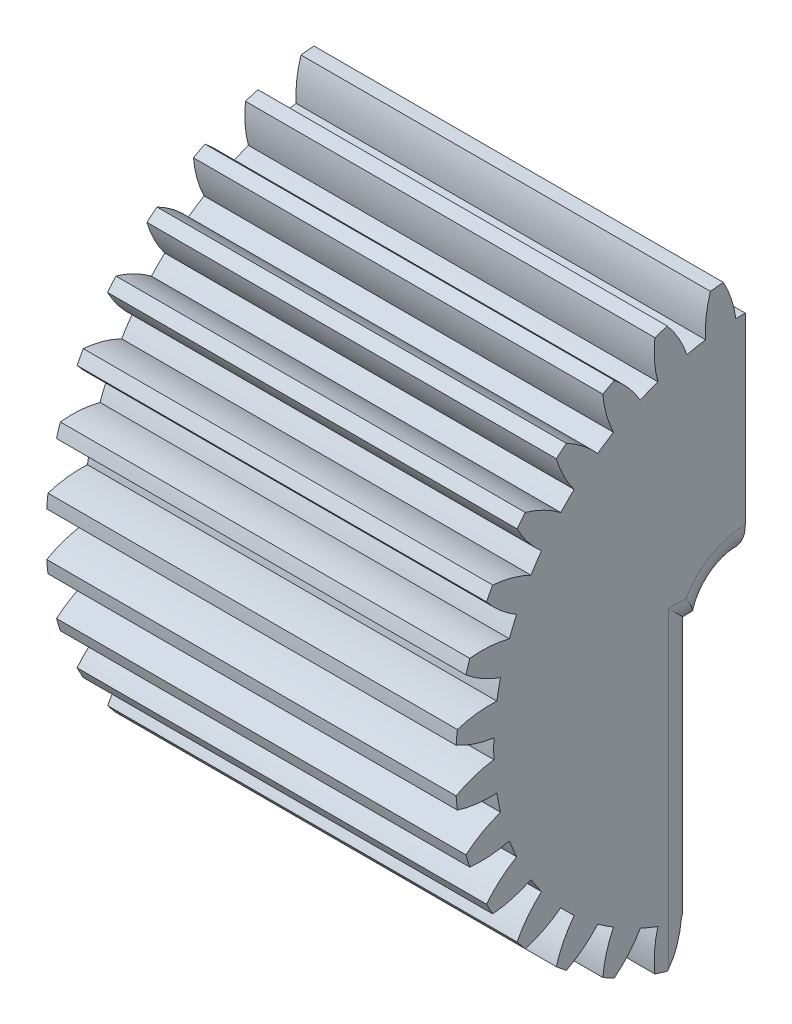
from build123d import *

# Parameters (mm, degrees)
BASPROSKE_W         = 10
BASPROSKE_H         = 8.5
TOOTHCUT_DEPTH      = 16.636495771
TEETHCUTS_COUNT     = 32
TEETHCUTS_ANGLE     = 348.75
BORSKE_R            = 1
BORE_DEPTH          = 50.0000508
SKETCH1_W           = 2.2
SKETCH1_H           = 12
CUT_EXTRUDE1_DEPTH  = 16.610070769
SKETCH4_R           = 1.125
SKETCH4_R_2         = 0.5
BOSS_EXTRUDE1_DEPTH = 0.5
BOSS_EXTRUDE2_REACH = 18.234
SKETCH5_W           = 2.5
SKETCH5_H           = 8.148803967
SKETCH6_R           = 2.25
CUT_EXTRUDE4_DEPTH  = 2.45
SKETCH7_R           = 0.5
CUT_EXTRUDE5_DEPTH  = 2.4
SKETCH8_W           = 11
SKETCH8_H           = 18
CUT_EXTRUDE6_DEPTH  = 10
SKETCH9_W           = 2
SKETCH9_H           = 2
BOSS_EXTRUDE3_DEPTH = 2
SKETCH10_W          = 1.25
SKETCH10_H          = 9
CUT_EXTRUDE7_DEPTH  = 7
BOSS_EXTRUDE4_REACH = 18.961
FILLET2_R           = 1


with BuildPart() as part:
    # BasProSke → Base-Revolve (revolve)
    with BuildSketch(Plane(origin=(0, 0, 0), x_dir=(1, 0, 0), z_dir=(0, 1, 0)), mode=Mode.PRIVATE) as base_revolve_sk:
        with Locations((5, 4.25)):
            Rectangle(BASPROSKE_W, BASPROSKE_H)
    revolve(base_revolve_sk.sketch.rotate(Axis((-10, 0, 0), (1, 0, 0)), 180), axis=Axis((-10, 0, 0), (1, 0, 0)))

    # TooCutSke → ToothCut (cut, through all)
    with BuildSketch(Plane(origin=(0, 0, 0), x_dir=(0, 0, -1), z_dir=(1, 0, 0))):
        with BuildLine():
            ThreePointArc((0.277002447, 7.3687954), (0, 7.374), (-0.277002447, 7.3687954))
            ThreePointArc((-0.277002447, 7.3687954), (-0.41335061, 7.952280695), (-0.656086882, 8.500117362))
            ThreePointArc((-0.656086882, 8.500117362), (0, 8.5254), (0.656086882, 8.500117362))
            ThreePointArc((0.656086882, 8.500117362), (0.41335061, 7.952280695), (0.277002447, 7.3687954))
        make_face()
    toothcut = extrude(amount=TOOTHCUT_DEPTH, mode=Mode.SUBTRACT)

    # TeethCuts: ToothCut ×32 about axis
    teethcuts_axis = Axis((-10, 0, 0), (1, 0, 0))
    for i in range(1, TEETHCUTS_COUNT):
        add(toothcut.rotate(teethcuts_axis, i * TEETHCUTS_ANGLE / (TEETHCUTS_COUNT - 1)), mode=Mode.SUBTRACT)

    # BorSke → Bore (cut, symmetric)
    with BuildSketch(Plane(origin=(0, 0, 0), x_dir=(0, 0, -1), z_dir=(1, 0, 0))):
        with Locations(Location((0, 0, 0), (0, 0, 180))):
            Circle(BORSKE_R)
    extrude(amount=BORE_DEPTH, both=True, mode=Mode.SUBTRACT)

    # Sketch1 → Cut-Extrude1 (cut, through all)
    with BuildSketch(Plane(origin=(10, 0, 0), x_dir=(0, 0, -1), z_dir=(1, 0, 0))):
        with Locations((0, -6)):
            Rectangle(SKETCH1_W, SKETCH1_H)
    extrude(amount=-CUT_EXTRUDE1_DEPTH, mode=Mode.SUBTRACT)

    # Sketch2 → Cut-Revolve1 (revolve, cut)
    with BuildSketch(Plane.XY):
        with BuildLine():
            Line((3.25, 0), (8.75, 0))
            ThreePointArc((8.75, 0), (6, 2.75), (3.25, 0))
        make_face()
    revolve(axis=Axis((3.25, 0, 0), (1, 0, 0)), mode=Mode.SUBTRACT)

    # Sketch4 → Boss-Extrude1 (add)
    with BuildSketch(Plane.ZY.offset(-3)):
        Circle(SKETCH4_R)
        Circle(SKETCH4_R_2, mode=Mode.SUBTRACT)
    extrude(amount=BOSS_EXTRUDE1_DEPTH)

    # Sketch5 → Boss-Extrude2 (add, up to next)
    with BuildSketch(Plane.XY.offset(-1.1), mode=Mode.PRIVATE) as boss_extrude2_sk1:
        with Locations((1.25, -4.074401984)):
            Rectangle(SKETCH5_W, SKETCH5_H)
    boss_extrude2_tool1 = extrude(boss_extrude2_sk1.sketch, amount=BOSS_EXTRUDE2_REACH, mode=Mode.PRIVATE) - part.part
    add(boss_extrude2_tool1.solids().sort_by_distance((1.25, -4.074402, -1.1))[0])

    # Sketch6 → Cut-Extrude4 (cut)
    with BuildSketch(Plane.ZY):
        Circle(SKETCH6_R)
    extrude(amount=-CUT_EXTRUDE4_DEPTH, mode=Mode.SUBTRACT)

    # Sketch7 → Cut-Extrude5 (cut)
    with BuildSketch(Plane(origin=(2.5, 0, 0), x_dir=(0, 0, -1), z_dir=(1, 0, 0))):
        with Locations(Location((0, 0, 0), (0, 0, 180))):
            Circle(SKETCH7_R)
    extrude(amount=-CUT_EXTRUDE5_DEPTH, mode=Mode.SUBTRACT)

    # Sketch8 → Cut-Extrude6 (cut)
    with BuildSketch(Plane.XY):
        with Locations((5, 0)):
            Rectangle(SKETCH8_W, SKETCH8_H)
    extrude(amount=-CUT_EXTRUDE6_DEPTH, mode=Mode.SUBTRACT)

    # Sketch9 → Boss-Extrude3 (add)
    with BuildSketch(Plane(origin=(0, 0, 0), x_dir=(-1, 0, 0), z_dir=(0, 0, -1))):
        with Locations((-7.5, 4.75)):
            Rectangle(SKETCH9_W, SKETCH9_H)
        with Locations((-2.5, 4.75)):
            Rectangle(SKETCH9_W, SKETCH9_H)
    extrude(amount=BOSS_EXTRUDE3_DEPTH)

    # Sketch10 → Cut-Extrude7 (cut)
    with BuildSketch(Plane(origin=(10, 0, 0), x_dir=(0, 0, -1), z_dir=(1, 0, 0))):
        with Locations((-0.625, -4.5)):
            Rectangle(SKETCH10_W, SKETCH10_H)
    extrude(amount=-CUT_EXTRUDE7_DEPTH, mode=Mode.SUBTRACT)

    # Sketch11 → Boss-Extrude4 (add, up to next)
    with BuildSketch(Plane(origin=(12, 0, 0), x_dir=(0, 0, -1), z_dir=(1, 0, 0)), mode=Mode.PRIVATE) as boss_extrude4_sk1:
        with BuildLine():
            Line((-1.25, 0), (-1.25, -7.267281197))
            ThreePointArc((-1.25, -7.267281197), (-1.480378414, -7.223874013), (-1.70926059, -7.173165566))
            ThreePointArc((-1.70926059, -7.173165566), (-1.949908855, -7.706695879), (-2.283707519, -8.187470914))
            ThreePointArc((-2.283707519, -8.187470914), (-2.467419757, -8.133992854), (-2.649881718, -8.076393185))
            ThreePointArc((-2.649881718, -8.076393185), (-2.660320865, -7.491194752), (-2.563999025, -6.913883496))
            ThreePointArc((-2.563999025, -6.913883496), (-2.82190763, -6.812687673), (-3.075832807, -6.701875002))
            ThreePointArc((-3.075832807, -6.701875002), (-3.415943684, -7.178205532), (-3.837123056, -7.584621721))
            ThreePointArc((-3.837123056, -7.584621721), (-4.006872263, -7.496330747), (-4.174591131, -7.404241277))
            ThreePointArc((-4.174591131, -7.404241277), (-4.070663142, -6.828250691), (-3.86356426, -6.280823768))
            ThreePointArc((-3.86356426, -6.280823768), (-4.096774898, -6.131256921), (-4.324202495, -5.97303514))
            ThreePointArc((-4.324202495, -5.97303514), (-4.750705713, -6.373860772), (-5.243080107, -6.690299769))
            ThreePointArc((-5.243080107, -6.690299769), (-5.392342915, -6.570588854), (-5.538873348, -6.447548529))
            ThreePointArc((-5.538873348, -6.447548529), (-5.324572118, -5.902900785), (-5.014654888, -5.406395505))
            ThreePointArc((-5.014654888, -5.406395505), (-5.214205404, -5.214205404), (-5.406395505, -5.014654888))
            ThreePointArc((-5.406395505, -5.014654888), (-5.902900785, -5.324572118), (-6.447548529, -5.538873348))
            ThreePointArc((-6.447548529, -5.538873348), (-6.570588854, -5.392342915), (-6.690299769, -5.243080107))
            ThreePointArc((-6.690299769, -5.243080107), (-6.373860772, -4.750705713), (-5.97303514, -4.324202495))
            ThreePointArc((-5.97303514, -4.324202495), (-6.131256921, -4.096774898), (-6.280823768, -3.86356426))
            ThreePointArc((-6.280823768, -3.86356426), (-6.828250691, -4.070663142), (-7.404241277, -4.174591131))
            ThreePointArc((-7.404241277, -4.174591131), (-7.496330747, -4.006872263), (-7.584621721, -3.837123056))
            ThreePointArc((-7.584621721, -3.837123056), (-7.178205532, -3.415943684), (-6.701875002, -3.075832807))
            ThreePointArc((-6.701875002, -3.075832807), (-6.812687673, -2.82190763), (-6.913883496, -2.563999025))
            ThreePointArc((-6.913883496, -2.563999025), (-7.491194752, -2.660320865), (-8.076393185, -2.649881718))
            ThreePointArc((-8.076393185, -2.649881718), (-8.133992854, -2.467419757), (-8.187470914, -2.283707519))
            ThreePointArc((-8.187470914, -2.283707519), (-7.706695879, -1.949908855), (-7.173165566, -1.70926059))
            ThreePointArc((-7.173165566, -1.70926059), (-7.232310658, -1.438596035), (-7.281246559, -1.165900745))
            ThreePointArc((-7.281246559, -1.165900745), (-7.866256399, -1.14774395), (-8.438173832, -1.023338837))
            ThreePointArc((-8.438173832, -1.023338837), (-8.459070177, -0.833145693), (-8.475680191, -0.642530382))
            ThreePointArc((-8.475680191, -0.642530382), (-7.939022225, -0.408940123), (-7.3687954, -0.277002447))
            ThreePointArc((-7.3687954, -0.277002447), (-7.374, 0), (-7.3687954, 0.277002447))
            ThreePointArc((-7.3687954, 0.277002447), (-7.939022225, 0.408940123), (-8.475680191, 0.642530382))
            ThreePointArc((-8.475680191, 0.642530382), (-8.459070177, 0.833145693), (-8.438173832, 1.023338837))
            ThreePointArc((-8.438173832, 1.023338837), (-7.866256399, 1.14774395), (-7.281246559, 1.165900745))
            ThreePointArc((-7.281246559, 1.165900745), (-7.232310658, 1.438596035), (-7.173165566, 1.70926059))
            ThreePointArc((-7.173165566, 1.70926059), (-7.706695879, 1.949908855), (-8.187470914, 2.283707519))
            ThreePointArc((-8.187470914, 2.283707519), (-8.133992854, 2.467419757), (-8.076393185, 2.649881718))
            ThreePointArc((-8.076393185, 2.649881718), (-7.491194752, 2.660320865), (-6.913883496, 2.563999025))
            ThreePointArc((-6.913883496, 2.563999025), (-6.812687673, 2.82190763), (-6.701875002, 3.075832807))
            ThreePointArc((-6.701875002, 3.075832807), (-7.178205532, 3.415943684), (-7.584621721, 3.837123056))
            ThreePointArc((-7.584621721, 3.837123056), (-7.496330747, 4.006872263), (-7.404241277, 4.174591131))
            ThreePointArc((-7.404241277, 4.174591131), (-6.828250691, 4.070663142), (-6.280823768, 3.86356426))
            ThreePointArc((-6.280823768, 3.86356426), (-6.131256921, 4.096774898), (-5.97303514, 4.324202495))
            ThreePointArc((-5.97303514, 4.324202495), (-6.373860772, 4.750705713), (-6.690299769, 5.243080107))
            ThreePointArc((-6.690299769, 5.243080107), (-6.570588854, 5.392342915), (-6.447548529, 5.538873348))
            ThreePointArc((-6.447548529, 5.538873348), (-5.902900785, 5.324572118), (-5.406395505, 5.014654888))
            ThreePointArc((-5.406395505, 5.014654888), (-5.214205404, 5.214205404), (-5.014654888, 5.406395505))
            ThreePointArc((-5.014654888, 5.406395505), (-5.324572118, 5.902900785), (-5.538873348, 6.447548529))
            ThreePointArc((-5.538873348, 6.447548529), (-5.392342915, 6.570588854), (-5.243080107, 6.690299769))
            ThreePointArc((-5.243080107, 6.690299769), (-4.750705713, 6.373860772), (-4.324202495, 5.97303514))
            ThreePointArc((-4.324202495, 5.97303514), (-4.096774898, 6.131256921), (-3.86356426, 6.280823768))
            ThreePointArc((-3.86356426, 6.280823768), (-4.070663142, 6.828250691), (-4.174591131, 7.404241277))
            ThreePointArc((-4.174591131, 7.404241277), (-4.006872263, 7.496330747), (-3.837123056, 7.584621721))
            ThreePointArc((-3.837123056, 7.584621721), (-3.415943684, 7.178205532), (-3.075832807, 6.701875002))
            ThreePointArc((-3.075832807, 6.701875002), (-2.82190763, 6.812687673), (-2.563999025, 6.913883496))
            ThreePointArc((-2.563999025, 6.913883496), (-2.660320865, 7.491194752), (-2.649881718, 8.076393185))
            ThreePointArc((-2.649881718, 8.076393185), (-2.467419757, 8.133992854), (-2.283707519, 8.187470914))
            ThreePointArc((-2.283707519, 8.187470914), (-1.949908855, 7.706695879), (-1.70926059, 7.173165566))
            ThreePointArc((-1.70926059, 7.173165566), (-1.438596035, 7.232310658), (-1.165900745, 7.281246559))
            ThreePointArc((-1.165900745, 7.281246559), (-1.14774395, 7.866256399), (-1.023338837, 8.438173832))
            ThreePointArc((-1.023338837, 8.438173832), (-0.833145693, 8.459070177), (-0.642530382, 8.475680191))
            ThreePointArc((-0.642530382, 8.475680191), (-0.408940123, 7.939022225), (-0.277002447, 7.3687954))
            ThreePointArc((-0.277002447, 7.3687954), (-0.138525669, 7.372698735), (0, 7.374))
            Line((0, 7.374), (0, 1))
            ThreePointArc((0, 1), (-0.707106781, 0.707106781), (-1, 0))
            Line((-1, 0), (-1.25, 0))
        make_face()
    boss_extrude4_tool1 = extrude(boss_extrude4_sk1.sketch, amount=-BOSS_EXTRUDE4_REACH, mode=Mode.PRIVATE) - part.part
    add(boss_extrude4_tool1.solids().sort_by_distance((12, 0.4527, 3.714882))[0])

    # Fillet2
    fillet2_edges = [part.edges().sort_by_distance(p)[0] for p in [
        (12, -3.633640599, 1.25),
        (12, 0, 1.125),
        (12, 0.707106781, 0.707106781),
    ]]
    fillet(fillet2_edges, radius=FILLET2_R)


solid = part.part
